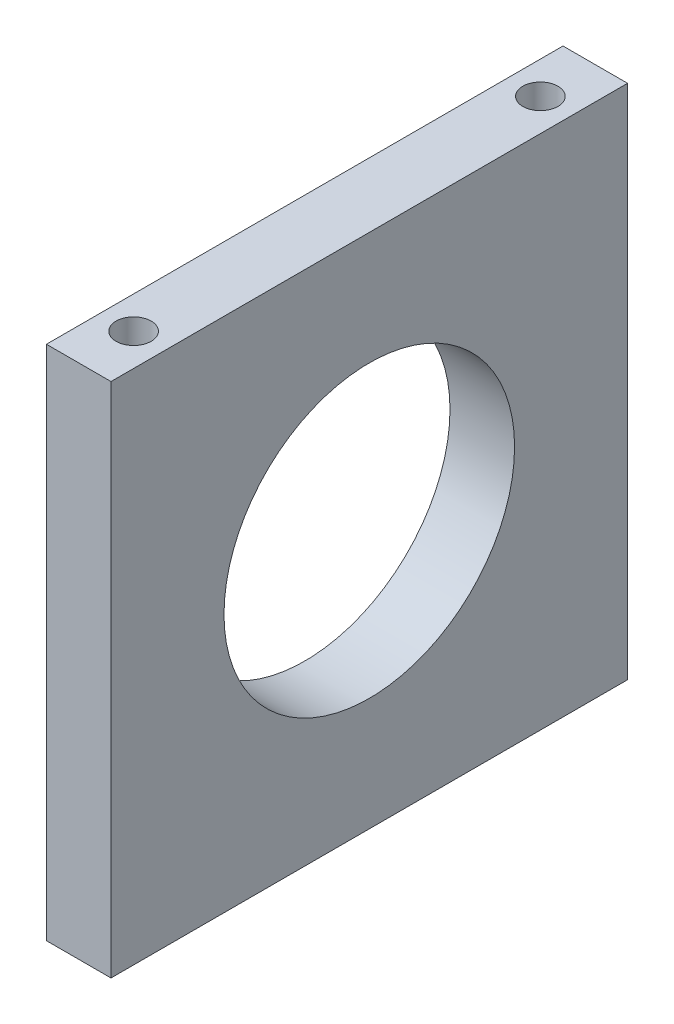
from build123d import *

# Parameters (mm, degrees)
SKETCH1_W                       = 50.8
SKETCH1_H                       = 50.8
SKETCH1_R                       = 14.2875
BOSS_EXTRUDE1_DEPTH             = 3.175
F_29_0_136_DIAMETER_HOLE1_D     = 3.4544
F_29_0_136_DIAMETER_HOLE1_DEPTH = 38.1
F_29_0_136_DIAMETER_HOLE1_TIP   = 1.037806461


with BuildPart() as part:
    # Sketch1 → Boss-Extrude1 (new, symmetric)
    with BuildSketch(Plane(origin=(0, 0, 0), x_dir=(0, 0, -1), z_dir=(1, 0, 0))):
        Rectangle(SKETCH1_W, SKETCH1_H)
        Circle(SKETCH1_R, mode=Mode.SUBTRACT)
    extrude(amount=BOSS_EXTRUDE1_DEPTH, both=True)

    # #29 (0.136) Diameter Hole1
    with Locations(Plane(origin=(0, 25.4, 20.0025), x_dir=(0, 0, 1), z_dir=(0, 1, 0))):
        with Locations((0, 0), (-40.005, 0)):
            Hole(F_29_0_136_DIAMETER_HOLE1_D / 2, depth=F_29_0_136_DIAMETER_HOLE1_DEPTH)
            with Locations((0, 0, -(F_29_0_136_DIAMETER_HOLE1_DEPTH + F_29_0_136_DIAMETER_HOLE1_TIP / 2))):  # 118° drill point
                Cone(0, F_29_0_136_DIAMETER_HOLE1_D / 2, F_29_0_136_DIAMETER_HOLE1_TIP, mode=Mode.SUBTRACT)


solid = part.part
